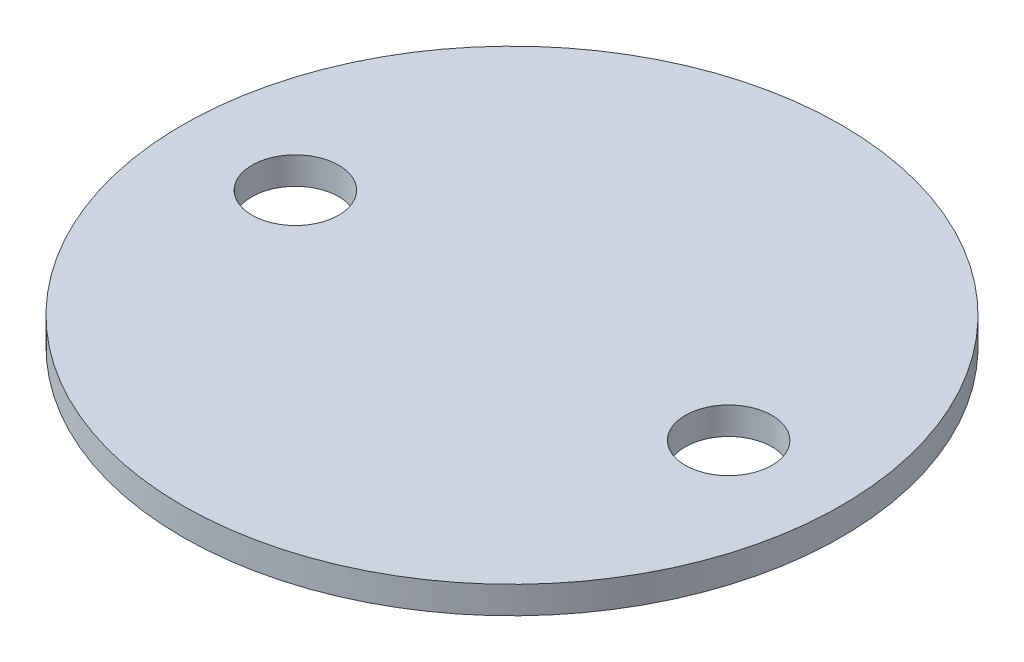
from build123d import *

# Parameters (mm, degrees)
SKETCH1_R           = 24.15
SKETCH1_R_2         = 3.175
BOSS_EXTRUDE1_DEPTH = 2


with BuildPart() as part:
    # Sketch1 → Boss-Extrude1 (new body)
    with BuildSketch(Plane(origin=(0, 0, 0), x_dir=(1, 0, 0), z_dir=(0, 1, 0))):
        with Locations(Location((0, 0, 0), (0, 0, 270))):
            Circle(SKETCH1_R)
        with Locations(Location((-15.875, 0, 0), (0, 0, 270))):
            Circle(SKETCH1_R_2, mode=Mode.SUBTRACT)
        with Locations(Location((15.875, 0, 0), (0, 0, 270))):
            Circle(SKETCH1_R_2, mode=Mode.SUBTRACT)
    extrude(amount=BOSS_EXTRUDE1_DEPTH)


solid = part.part
